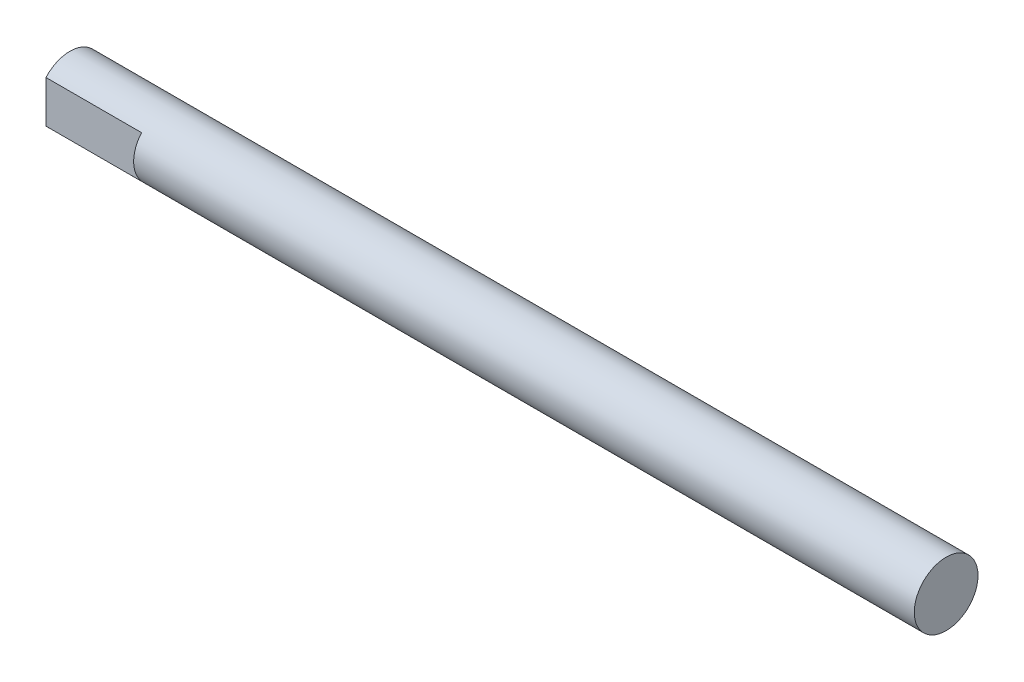
from build123d import *

# Parameters (mm, degrees)
SKETCH1_R           = 2
BOSS_EXTRUDE1_DEPTH = 55
CUT_EXTRUDE1_DEPTH  = 6


with BuildPart() as part:
    # Sketch1 → Boss-Extrude1 (new body)
    with BuildSketch(Plane.YZ):
        with Locations(Location((0, 0, 0), (0, 0, 270))):
            Circle(SKETCH1_R)
    extrude(amount=BOSS_EXTRUDE1_DEPTH)

    # Sketch2 → Cut-Extrude1 (cut)
    with BuildSketch(Plane(origin=(0, 0, 0), x_dir=(0, -1, 0), z_dir=(-1, 0, 0))):
        with BuildLine():
            Line((-1.322875656, 1.5), (1.322875656, 1.5))
            ThreePointArc((1.322875656, 1.5), (0, 2), (-1.322875656, 1.5))
        make_face()
    extrude(amount=-CUT_EXTRUDE1_DEPTH, mode=Mode.SUBTRACT)


solid = part.part
